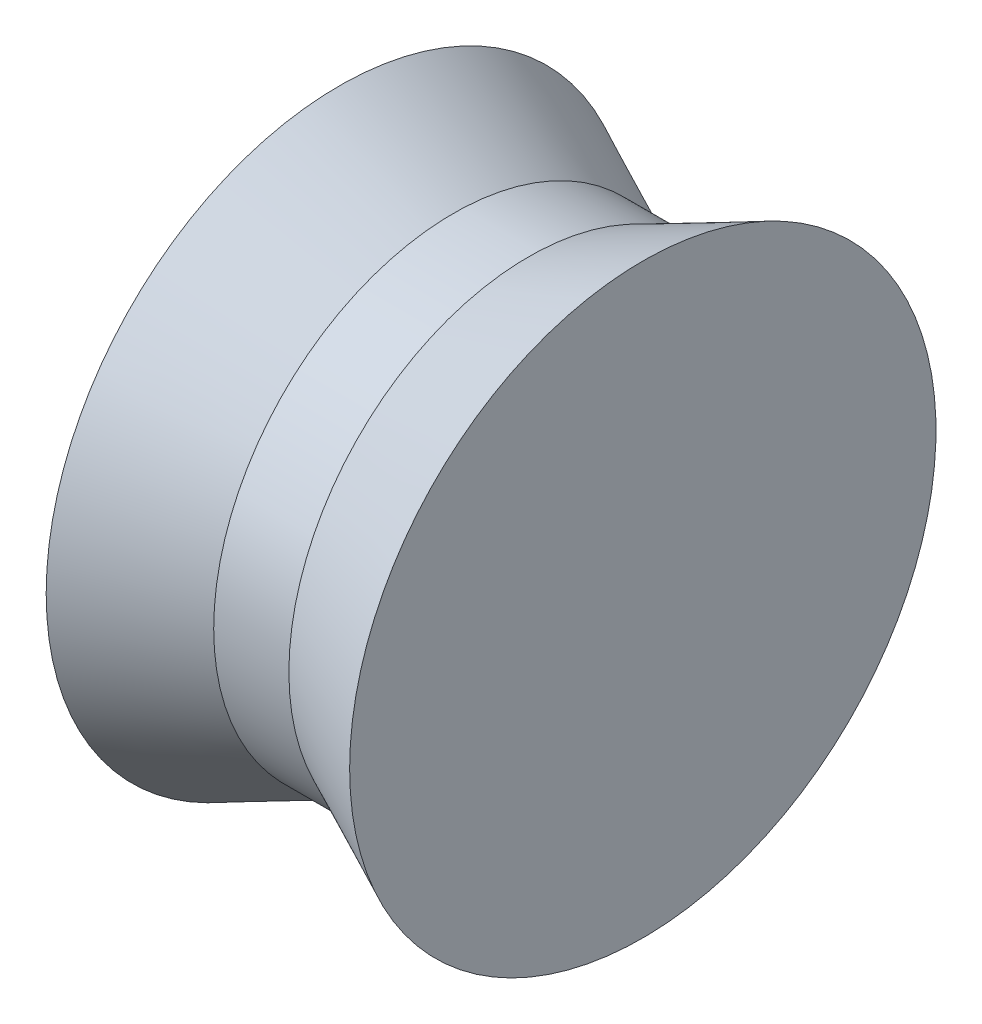
from build123d import *


with BuildPart() as part:
    # Sketch1 → Revolve1 (revolve)
    with BuildSketch(Plane.XY, mode=Mode.PRIVATE) as revolve1_sk:
        Polygon((-25.12500102, 0), (25.12500102, 0), (25.12500102, 48.549624237), (6.22554836, 39.710161014), (-6.22554836, 39.710161014), (-25.12500102, 48.549624237), align=None)
    revolve(revolve1_sk.sketch.rotate(Axis((-25.12500102, 0, 0), (1, 0, 0)), 90), axis=Axis((-25.12500102, 0, 0), (1, 0, 0)))


solid = part.part
